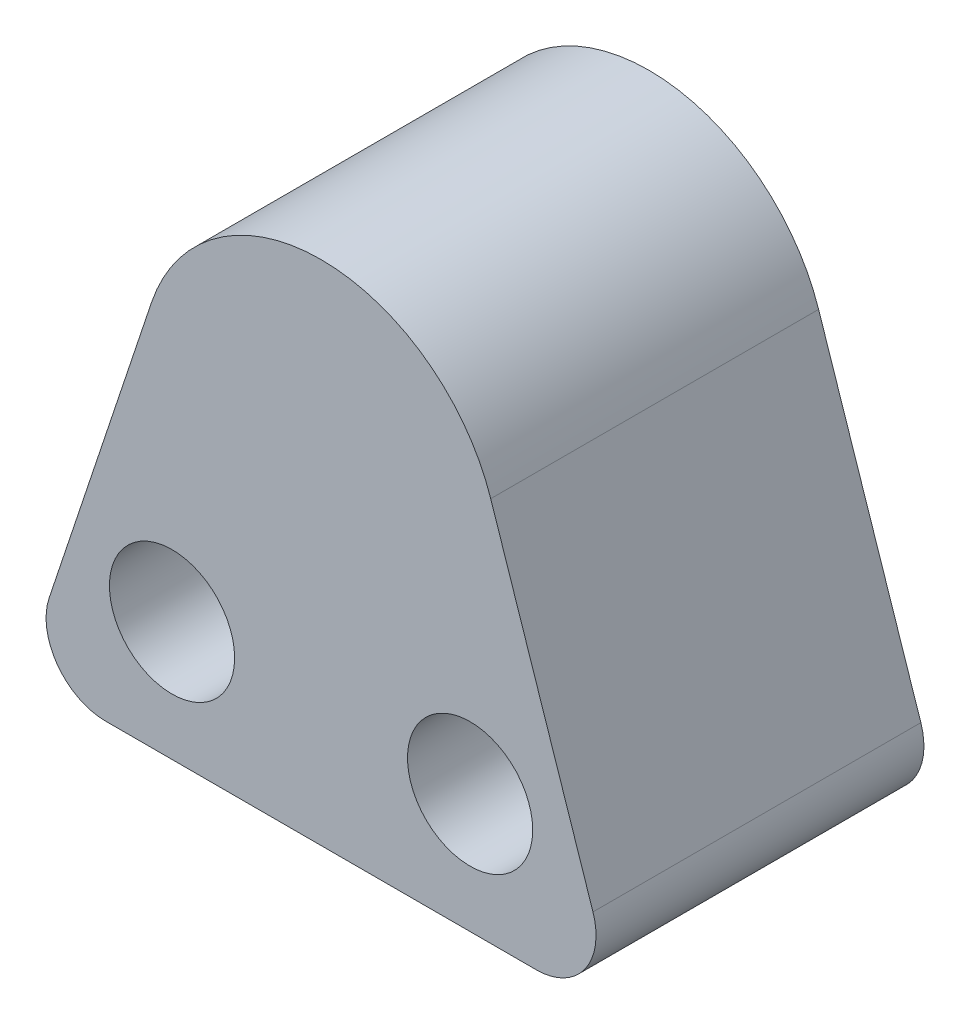
from build123d import *

# Parameters (mm, degrees)
EXTRUDE_1_DEPTH     = 5.5
FILLET_1_R          = 1
SKETCH_2_R          = 1.05
CUT_EXTRUDE_1_DEPTH = 17.629066118
FILLET_2_R          = 3


with BuildPart() as part:
    # ｽｹｯﾁ1 → ﾎﾞｽ - 押し出し1 (new body)
    with BuildSketch(Plane.XY):
        Polygon((-5, 0), (5, 0), (0, 15), align=None)
    extrude(amount=EXTRUDE_1_DEPTH)

    # ﾌｨﾚｯﾄ1
    fillet_1_edges = [part.edges().sort_by_distance(p)[0] for p in [
        (5, 0, 2.75),
        (-5, 0, 2.75),
    ]]
    fillet(fillet_1_edges, radius=FILLET_1_R)

    # ｽｹｯﾁ2 → ｶｯﾄ - 押し出し1 (cut, through all)
    with BuildSketch(Plane.XY.offset(5.5)):
        with Locations((-2.5, 2)):
            Circle(SKETCH_2_R)
        with Locations((2.5, 2)):
            Circle(SKETCH_2_R)
    extrude(amount=-CUT_EXTRUDE_1_DEPTH, mode=Mode.SUBTRACT)

    # ﾌｨﾚｯﾄ2
    fillet_2_edges = [part.edges().sort_by_distance(p)[0] for p in [
        (0, 15, 2.75),
    ]]
    fillet(fillet_2_edges, radius=FILLET_2_R)


solid = part.part
